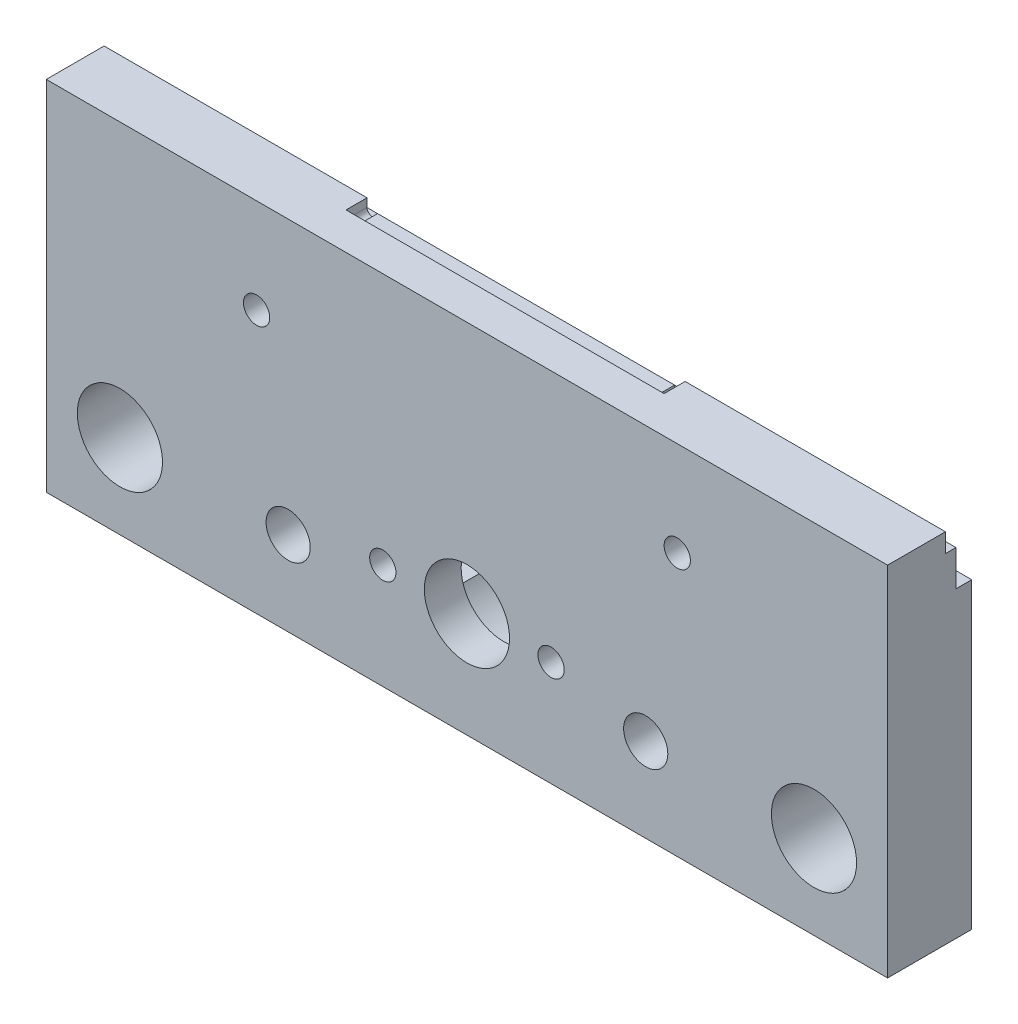
from build123d import *

# Parameters (mm, degrees)
SKETCH_2_W           = 80
SKETCH_2_H           = 34
SKETCH_2_R           = 4.05
EXTRUDE_1_DEPTH      = 8
CUT_EXTRUDE_2_DEPTH  = 88.292611371
CUT_EXTRUDE_12_DEPTH = 4.5
SKETCH_20_R          = 6.25
CUT_EXTRUDE_13_DEPTH = 4.5
CUT_EXTRUDE_11_DEPTH = 2
HOLE_WIZARD_M3_7_D   = 2.5
HOLE_WIZARD_M5_1_D   = 4.2


with BuildPart() as part:
    # 草图2 → 凸台-拉伸1 (new body)
    with BuildSketch(Plane.XY):
        with Locations((40, 17)):
            Rectangle(SKETCH_2_W, SKETCH_2_H)
        with Locations((7, 8)):
            Circle(SKETCH_2_R, mode=Mode.SUBTRACT)
        with Locations((40, 10)):
            Circle(SKETCH_2_R, mode=Mode.SUBTRACT)
        with Locations((73, 8)):
            Circle(SKETCH_2_R, mode=Mode.SUBTRACT)
    extrude(amount=EXTRUDE_1_DEPTH)

    # 草图4 → 切除-拉伸2 (cut, through all)
    with BuildSketch(Plane(origin=(80, 0, 0), x_dir=(0, 0, -1), z_dir=(1, 0, 0))):
        Polygon((-1.5, 32.2), (-2.5, 32.2), (-2.5, 34), (0, 34), (0, 28.8), (-1.5, 28.8), align=None)
    extrude(amount=-CUT_EXTRUDE_2_DEPTH, mode=Mode.SUBTRACT)

    # 草图8 → 切除-拉伸12 (cut)
    with BuildSketch(Plane(origin=(0, 0, 0), x_dir=(-1, 0, 0), z_dir=(0, 0, -1))):
        with BuildLine():
            Line((-30.5, 12.85), (-49.5, 12.85))
            ThreePointArc((-49.5, 12.85), (-52.35, 10), (-49.5, 7.15))
            Line((-49.5, 7.15), (-30.5, 7.15))
            ThreePointArc((-30.5, 7.15), (-27.65, 10), (-30.5, 12.85))
        make_face()
    extrude(amount=-CUT_EXTRUDE_12_DEPTH, mode=Mode.SUBTRACT)

    # 草图20 → 切除-拉伸13 (cut)
    with BuildSketch(Plane(origin=(0, 0, 0), x_dir=(-1, 0, 0), z_dir=(0, 0, -1))):
        with Locations((-40, 10)):
            Circle(SKETCH_20_R)
    extrude(amount=-CUT_EXTRUDE_13_DEPTH, mode=Mode.SUBTRACT)

    # 草图19 → 切除-拉伸11 (cut)
    with BuildSketch(Plane(origin=(0, 0, 2.5), x_dir=(-1, 0, 0), z_dir=(0, 0, -1))):
        with BuildLine():
            Line((-25, 34), (-55.247938178, 34))
            Line((-55.247938178, 34), (-55.247938178, 33.2))
            ThreePointArc((-55.247938178, 33.2), (-54.747938178, 32.7), (-54.247938178, 33.2))
            Line((-54.247938178, 33.2), (-26, 33.2))
            ThreePointArc((-26, 33.2), (-25.5, 32.7), (-25, 33.2))
            Line((-25, 33.2), (-25, 34))
        make_face()
    extrude(amount=-CUT_EXTRUDE_11_DEPTH, mode=Mode.SUBTRACT)

    # M3 螺纹孔7 (through all)
    with Locations(Plane.XY.offset(8)):
        with Locations((20, 25), (60, 25), (32, 10), (48, 10)):
            Hole(HOLE_WIZARD_M3_7_D / 2)

    # M5 螺纹孔1 (through all)
    with Locations(Plane.XY.offset(8)):
        with Locations((23, 8), (57, 8)):
            Hole(HOLE_WIZARD_M5_1_D / 2)


solid = part.part
